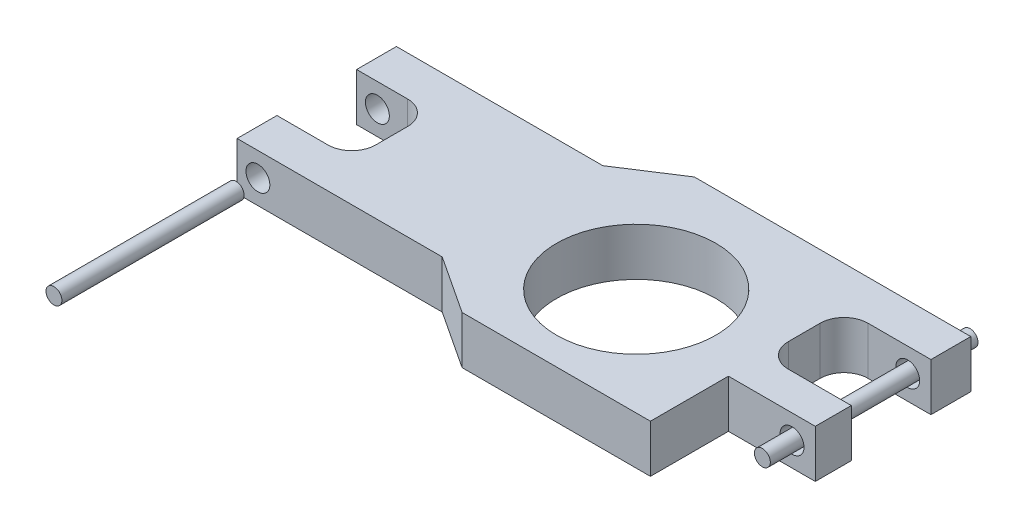
from build123d import *

# Parameters (mm, degrees)
SKETCH21_R         = 12.7
EXTRUDE1_DEPTH     = 3.81
SKETCH22_R         = 1.905
CUT_EXTRUDE1_DEPTH = 91.7575
SKETCH23_R         = 1.27
EXTRUDE2_DEPTH     = 33.114
EXTRUDE3_START     = 5.08
SKETCH23_3_R       = 1.27
EXTRUDE3_DEPTH     = 29.05


with BuildPart() as part:
    # Sketch21 → Extrude1 (new, symmetric)
    with BuildSketch(Plane(origin=(0, 0, 0), x_dir=(1, 0, 0), z_dir=(0, 1, 0))):
        with BuildLine():
            Line((-35.298929468, 23.7883192), (-68.202843987, 23.7883192))
            Line((-68.202843987, 23.7883192), (-68.202843987, 17.4383192))
            Line((-68.202843987, 17.4383192), (-60.073763005, 17.4383192))
            ThreePointArc((-60.073763005, 17.4383192), (-57.379686169, 16.322396036), (-56.263763005, 13.6283192))
            Line((-56.263763005, 13.6283192), (-56.263763005, 8.5483192))
            ThreePointArc((-56.263763005, 8.5483192), (-57.379686169, 5.854242364), (-60.073763005, 4.7383192))
            Line((-60.073763005, 4.7383192), (-68.202843987, 4.7383192))
            Line((-68.202843987, 4.7383192), (-68.202843987, -1.6116808))
            Line((-68.202843987, -1.6116808), (-35.497864952, -1.6116808))
            Line((-35.497864952, -1.6116808), (-26.24191989, -7.698649627))
            Line((-26.24191989, -7.698649627), (3.782541293, -7.698649627))
            Line((3.782541293, -7.698649627), (3.782541293, 4.7383192))
            Line((3.782541293, 4.7383192), (17.630956358, 4.7383192))
            Line((17.630956358, 4.7383192), (17.630956358, 10.478162824))
            Line((17.630956358, 10.478162824), (7.592541293, 10.478162824))
            ThreePointArc((7.592541293, 10.478162824), (4.898464456, 11.594085988), (3.782541293, 14.288162824))
            Line((3.782541293, 14.288162824), (3.782541293, 19.368162824))
            ThreePointArc((3.782541293, 19.368162824), (4.898464456, 22.062239661), (7.592541293, 23.178162824))
            Line((7.592541293, 23.178162824), (17.630956358, 23.178162824))
            Line((17.630956358, 23.178162824), (17.630956358, 29.528162824))
            Line((17.630956358, 29.528162824), (-26.437102079, 29.528162824))
            Line((-26.437102079, 29.528162824), (-35.298929468, 23.7883192))
        make_face()
        with Locations((-15.570369897, 9.388598571)):
            Circle(SKETCH21_R, mode=Mode.SUBTRACT)
    extrude(amount=EXTRUDE1_DEPTH, both=True)

    # Sketch22 → Cut-Extrude1 (cut, symmetric)
    with BuildSketch(Plane(origin=(0, 0, -29.528162824), x_dir=(-1, 0, 0), z_dir=(0, 0, -1))):
        with Locations((-13.928786076, 0)):
            Circle(SKETCH22_R)
        with Locations((64.887413377, 0.009280662)):
            Circle(SKETCH22_R)
    extrude(amount=CUT_EXTRUDE1_DEPTH, both=True, mode=Mode.SUBTRACT)


with BuildPart() as body_2:
    # Sketch23 → Extrude2 (new body)
    with BuildSketch(Plane.XY):
        with Locations((13.928786076, 0)):
            Circle(SKETCH23_R)
    extrude(amount=-EXTRUDE2_DEPTH)


with BuildPart() as body_3:
    # Sketch23<3> → Extrude3 (new body)
    with BuildSketch(Plane.XY.offset(EXTRUDE3_START)):
        with Locations((-64.887413377, 0.009280662)):
            Circle(SKETCH23_3_R)
    extrude(amount=EXTRUDE3_DEPTH)


solid = Compound([part.part, body_2.part, body_3.part])
